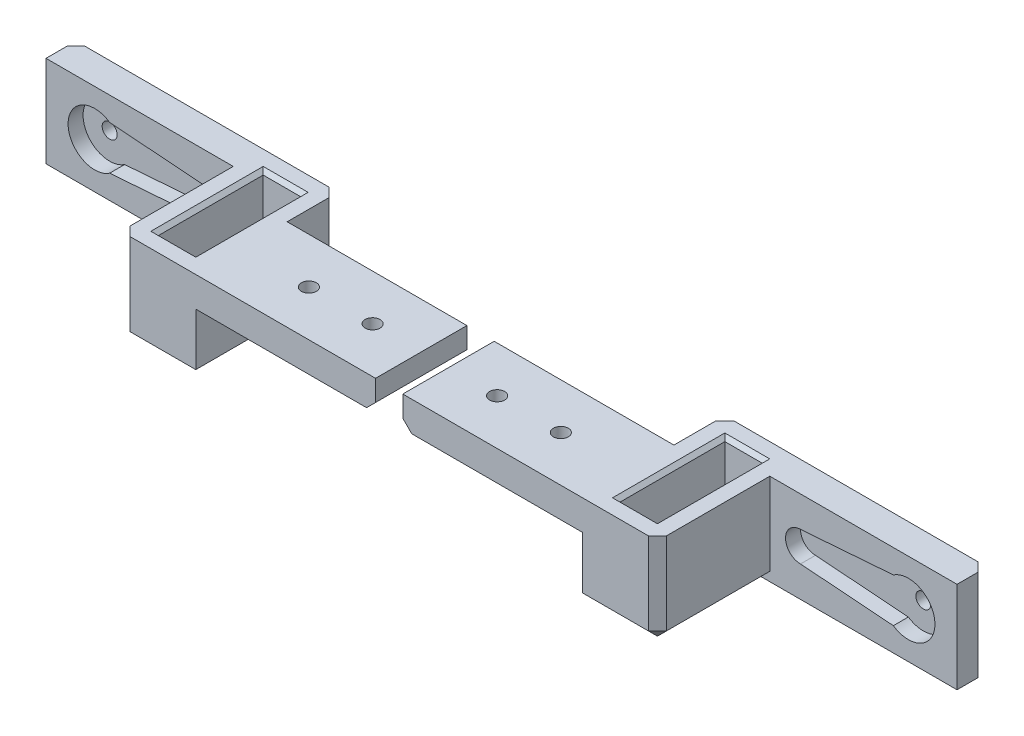
from build123d import *

# Parameters (mm, degrees)
SKETCH1_W               = 35
SKETCH1_H               = 12.2
BOSS_EXTRUDE1_DEPTH     = 4
SKETCH2_R               = 1
CUT_EXTRUDE1_DEPTH      = 38.656658625
SKETCH3_W               = 10
SKETCH3_H               = 12.2
BOSS_EXTRUDE2_DEPTH     = 15
SKETCH4_W               = 12.2
SKETCH4_H               = 4
BOSS_EXTRUDE3_DEPTH     = 24
CUT_EXTRUDE2_DEPTH      = 42.133377247
CUT_EXTRUDE2_DEPTH_BACK = 42.133377247
SKETCH5_R               = 1
CUT_EXTRUDE3_DEPTH      = 0.5
CHAMFER1_SIZE           = 1.2
CUT_EXTRUDE17_DEPTH     = 2
CUT_EXTRUDE18_DEPTH     = 2
SKETCH26_W              = 5
SKETCH26_H              = 14
CUT_EXTRUDE19_DEPTH     = 43.113593099
CHAMFER2_SIZE           = 0.5


with BuildPart() as part:
    # Sketch1 → Boss-Extrude1 (new body)
    with BuildSketch(Plane.XY):
        with Locations((-18.048765432, 5.660493827)):
            Rectangle(SKETCH1_W, SKETCH1_H)
    extrude(amount=BOSS_EXTRUDE1_DEPTH)

    # Sketch2 → Cut-Extrude1 (cut, through all)
    with BuildSketch(Plane.XY.offset(4)):
        with Locations((-29.048765432, 5.660493827)):
            Circle(SKETCH2_R)
    extrude(amount=-CUT_EXTRUDE1_DEPTH, mode=Mode.SUBTRACT)

    # Sketch3 → Boss-Extrude2 (add)
    with BuildSketch(Plane.XY.offset(4)):
        with Locations((-5.548765432, 5.660493827)):
            Rectangle(SKETCH3_W, SKETCH3_H)
    extrude(amount=BOSS_EXTRUDE2_DEPTH)

    # Sketch4 → Boss-Extrude3 (add)
    with BuildSketch(Plane(origin=(-0.548765432, 0, 0), x_dir=(0, 0, -1), z_dir=(1, 0, 0))):
        with Locations((-12.9, 9.760493827)):
            Rectangle(SKETCH4_W, SKETCH4_H)
    extrude(amount=BOSS_EXTRUDE3_DEPTH)

    # Sketch5 → Cut-Extrude2 (cut, two sides: drawn at the far end of the back side and taken through both)
    with BuildSketch(Plane.XZ.offset(-7.760493827).offset(-CUT_EXTRUDE2_DEPTH_BACK)):
        with Locations(Location((16.951234568, 12.9, 0), (0, 0, 270))):
            Circle(SKETCH5_R)
        with Locations(Location((8.451234568, 12.9, 0), (0, 0, 270))):
            Circle(SKETCH5_R)
    extrude(amount=CUT_EXTRUDE2_DEPTH + CUT_EXTRUDE2_DEPTH_BACK, mode=Mode.SUBTRACT)

    # Sketch7 → Cut-Extrude3 (cut)
    with BuildSketch(Plane(origin=(0, 0, 0), x_dir=(-1, 0, 0), z_dir=(0, 0, -1))):
        Polygon((23.048765432, 5.660493827), (19.298765432, 7.825557337), (19.298765432, 3.495430318), align=None)
    extrude(amount=-CUT_EXTRUDE3_DEPTH, mode=Mode.SUBTRACT)

    # Chamfer1
    chamfer1_edges = [part.edges().sort_by_distance(p)[0] for p in [
        (-10.548765432, -0.439506173, 11.5),
        (-10.548765432, 5.660493827, 19),
        (-5.548765432, -0.439506173, 19),
        (23.451234568, 7.760493827, 12.9),
        (-0.548765432, 5.660493827, 0),
        (-18.048765432, -0.439506173, 0),
        (-35.548765432, 5.660493827, 0),
        (-0.548765432, -0.439506173, 9.5),
    ]]
    chamfer(chamfer1_edges, length=CHAMFER1_SIZE)

    # Sketch24 → Cut-Extrude17 (cut)
    with BuildSketch(Plane.XY.offset(4)):
        with BuildLine():
            Line((-27.048765432, 2.727491952), (-14.648765432, 3.660493827))
            ThreePointArc((-14.648765432, 3.660493827), (-12.648765432, 5.660493827), (-14.648765432, 7.660493827))
            Line((-14.648765432, 7.660493827), (-27.048765432, 8.593495702))
            ThreePointArc((-27.048765432, 8.593495702), (-32.598765432, 5.660493827), (-27.048765432, 2.727491952))
        make_face()
    extrude(amount=-CUT_EXTRUDE17_DEPTH, mode=Mode.SUBTRACT)

    # Sketch25 → Cut-Extrude18 (cut)
    with BuildSketch(Plane.XZ.offset(-7.760493827)):
        with BuildLine():
            Line((2.551234568, 14.9), (14.951234568, 15.833001875))
            ThreePointArc((14.951234568, 15.833001875), (20.501234568, 12.9), (14.951234568, 9.966998125))
            Line((14.951234568, 9.966998125), (2.551234568, 10.9))
            ThreePointArc((2.551234568, 10.9), (0.551234568, 12.9), (2.551234568, 14.9))
        make_face()
    extrude(amount=-CUT_EXTRUDE18_DEPTH, mode=Mode.SUBTRACT)

    # Sketch26 → Cut-Extrude19 (cut, through all)
    with BuildSketch(Plane(origin=(0, 11.760493827, 0), x_dir=(1, 0, 0), z_dir=(0, 1, 0))):
        with Locations((-5.548765432, -9.5)):
            Rectangle(SKETCH26_W, SKETCH26_H)
    extrude(amount=-CUT_EXTRUDE19_DEPTH, mode=Mode.SUBTRACT)

    # Chamfer2
    chamfer2_edges = [part.edges().sort_by_distance(p)[0] for p in [
        (-8.048765432, -0.439506173, 9.5),
        (-5.548765432, -0.439506173, 2.5),
        (-3.048765432, -0.439506173, 9.5),
        (-5.548765432, -0.439506173, 16.5),
        (-8.048765432, 11.760493827, 9.5),
        (-5.548765432, 11.760493827, 16.5),
        (-3.048765432, 11.760493827, 9.5),
        (-5.548765432, 11.760493827, 2.5),
    ]]
    chamfer(chamfer2_edges, length=CHAMFER2_SIZE)


with BuildPart() as body_2:
    # Mirror1: mirrored copy
    add(part.part.mirror(Plane.ZY.offset(-25.270949191)))


solid = Compound([part.part, body_2.part])
